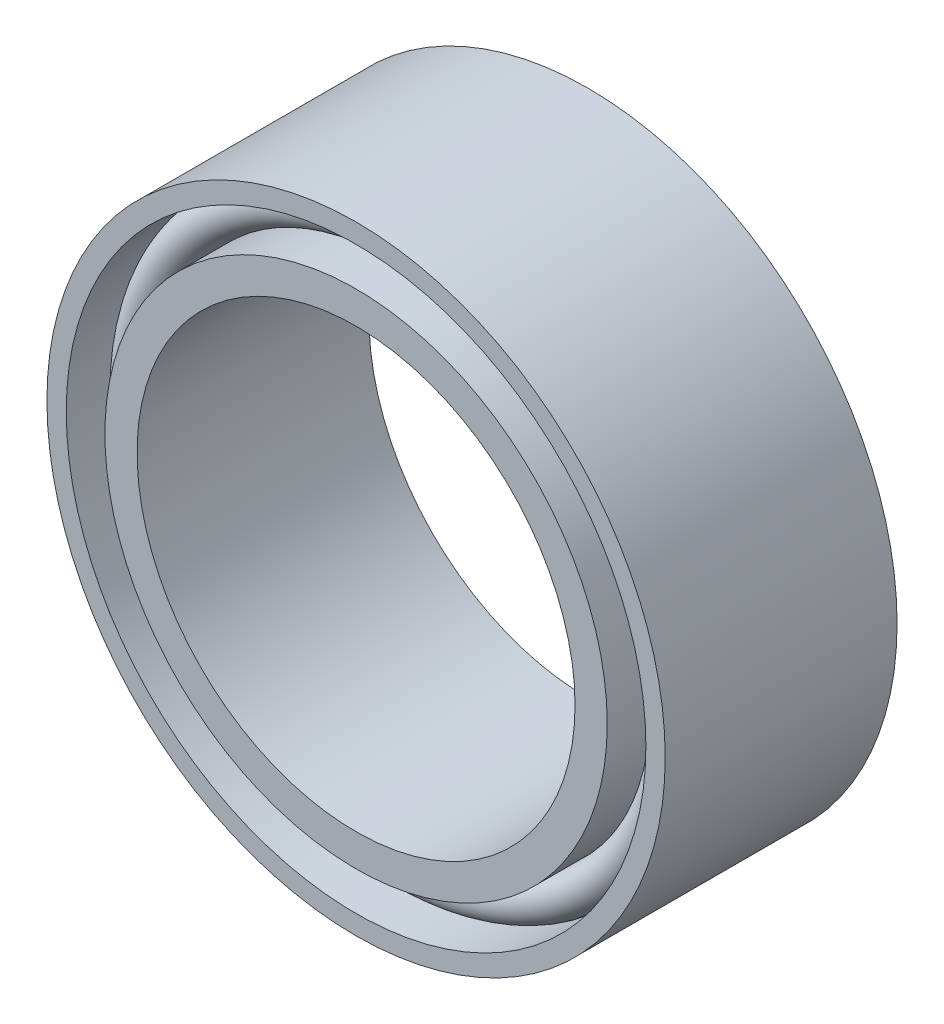
from build123d import *

# Parameters (mm, degrees)
IZIM1_R                     = 24
IZIM1_R_2                   = 22.5
Y_KSEKLIK_EKSTR_ZYON1_DEPTH = 18
IZIM2_R                     = 19.5
IZIM2_R_2                   = 17
Y_KSEKLIK_EKSTR_ZYON2_DEPTH = 18


with BuildPart() as part:
    # Çizim1 → Yükseklik-Ekstrüzyon1 (new body)
    with BuildSketch(Plane.XY):
        Circle(IZIM1_R)
        Circle(IZIM1_R_2, mode=Mode.SUBTRACT)
    extrude(amount=Y_KSEKLIK_EKSTR_ZYON1_DEPTH)

    # Çizim3 → Döndür1 (revolve)
    with BuildSketch(Plane(origin=(0, 0, 0), x_dir=(0, 0, -1), z_dir=(1, 0, 0)), mode=Mode.PRIVATE) as d_nd_r1_sk:
        with BuildLine():
            Line((-14, 22.5), (-4, 22.5))
            ThreePointArc((-4, 22.5), (-2.5, 21), (-4, 19.5))
            Line((-4, 19.5), (-14, 19.5))
            ThreePointArc((-14, 19.5), (-15.5, 21), (-14, 22.5))
        make_face()
    revolve(d_nd_r1_sk.sketch.rotate(Axis((0, 0, 0), (0, 0, 1)), 90), axis=Axis((0, 0, 0), (0, 0, 1)))


with BuildPart() as body_2:
    # Çizim2 → Yükseklik-Ekstrüzyon2 (new body)
    with BuildSketch(Plane.XY.offset(18)):
        Circle(IZIM2_R)
        Circle(IZIM2_R_2, mode=Mode.SUBTRACT)
    extrude(amount=-Y_KSEKLIK_EKSTR_ZYON2_DEPTH)


solid = Compound([part.part, body_2.part])
